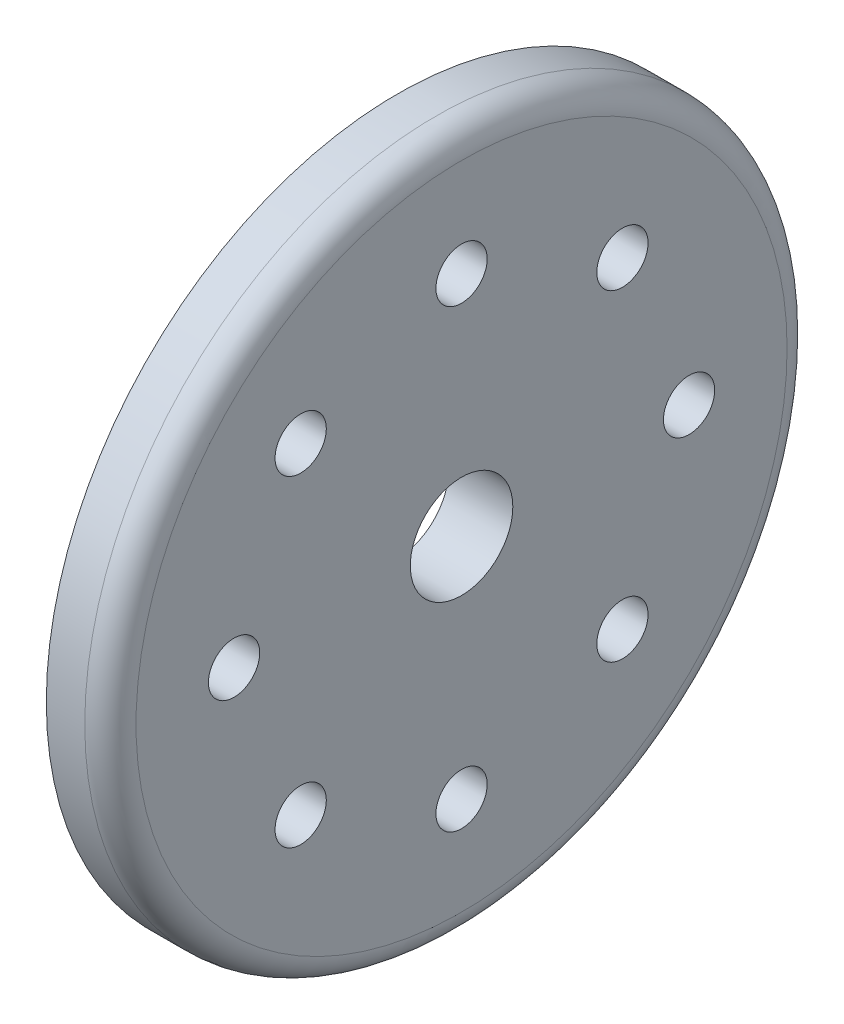
from build123d import *

# Parameters (mm, degrees)
SKETCH1_R           = 34.798
BOSS_EXTRUDE1_DEPTH = 6.35
FILLET1_R           = 2.54
SKETCH2_R           = 5.08
CUT_EXTRUDE1_DEPTH  = 6.35
SKETCH3_R           = 2.54
CUT_EXTRUDE2_DEPTH  = 19.05
CIRPATTERN1_COUNT   = 8


with BuildPart() as part:
    # Sketch1 → Boss-Extrude1 (new body)
    with BuildSketch(Plane(origin=(0, 0, 0), x_dir=(0, 0, -1), z_dir=(1, 0, 0))):
        Circle(SKETCH1_R)
    extrude(amount=BOSS_EXTRUDE1_DEPTH)

    # Fillet1
    fillet1_edges = [part.edges().sort_by_distance(p)[0] for p in [
        (6.35, 0, 34.798),
    ]]
    fillet(fillet1_edges, radius=FILLET1_R)

    # Sketch2 → Cut-Extrude1 (cut)
    with BuildSketch(Plane(origin=(6.35, 0, 0), x_dir=(0, 0, -1), z_dir=(1, 0, 0))):
        Circle(SKETCH2_R)
    extrude(amount=-CUT_EXTRUDE1_DEPTH, mode=Mode.SUBTRACT)

    # Sketch3 → Cut-Extrude2 (cut)
    with BuildSketch(Plane(origin=(6.35, 0, 0), x_dir=(0, 0, -1), z_dir=(1, 0, 0))):
        with Locations((22.543897228, 0)):
            Circle(SKETCH3_R)
    cut_extrude2 = extrude(amount=-CUT_EXTRUDE2_DEPTH, mode=Mode.SUBTRACT)

    # CirPattern1: Cut-Extrude2 ×8 about axis
    cirpattern1_axis = Axis((0, 0, 0), (1, 0, 0))
    for i in range(1, CIRPATTERN1_COUNT):
        add(cut_extrude2.rotate(cirpattern1_axis, i * 360 / CIRPATTERN1_COUNT), mode=Mode.SUBTRACT)


solid = part.part
